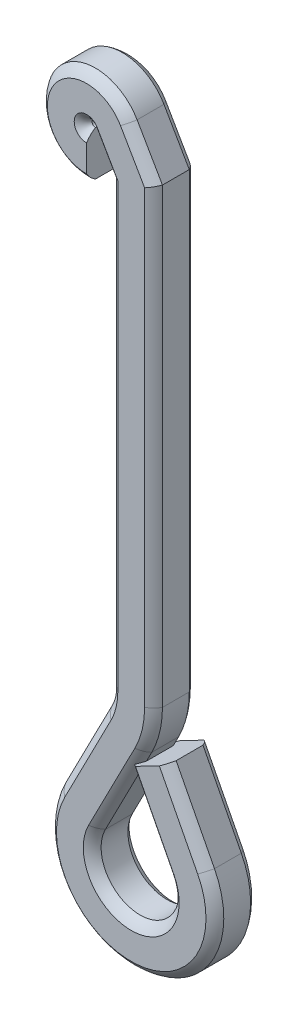
from build123d import *


with BuildPart() as part:
    # 掃出1: sweep along a path in 草圖1
    with BuildLine(Plane.XY) as sweep_1_path:
        Line((1.088041762, -2.111111111), (3.664982778, -7.111111111))
        ThreePointArc((3.664982778, -7.111111111), (0, -13.123105626), (-3.664982778, -7.111111111))
        Line((-3.664982778, -7.111111111), (-0.555555556, -1.077936111))
        ThreePointArc((-0.555555556, -1.077936111), (-0.140873421, 0.034166823), (0, 1.212678125))
        Line((0, 1.212678125), (0, 31.212678125))
        Line((0, 31.212678125), (-1.5, 33.810754337))
        ThreePointArc((-1.5, 33.810754337), (-4.5, 33.810754337), (-3, 31.212678125))
    # 草圖3 → 掃出1 (sweep)
    with BuildSketch(Plane(origin=(-3, 31.212678125, 0), x_dir=(0, 0, -1), z_dir=(1, 0, 0))):
        with BuildLine():
            Line((-0.901387819, 1.5), (0.901387819, 1.5))
            ThreePointArc((0.901387819, 1.5), (1.237436867, 1.237436867), (1.5, 0.901387819))
            Line((1.5, 0.901387819), (1.5, -0.901387819))
            ThreePointArc((1.5, -0.901387819), (1.237436867, -1.237436867), (0.901387819, -1.5))
            Line((0.901387819, -1.5), (-0.901387819, -1.5))
            ThreePointArc((-0.901387819, -1.5), (-1.237436867, -1.237436867), (-1.5, -0.901387819))
            Line((-1.5, -0.901387819), (-1.5, 0.901387819))
            ThreePointArc((-1.5, 0.901387819), (-1.237436867, 1.237436867), (-0.901387819, 1.5))
        make_face()
    sweep(path=sweep_1_path.line, transition=Transition.RIGHT)


solid = part.part
